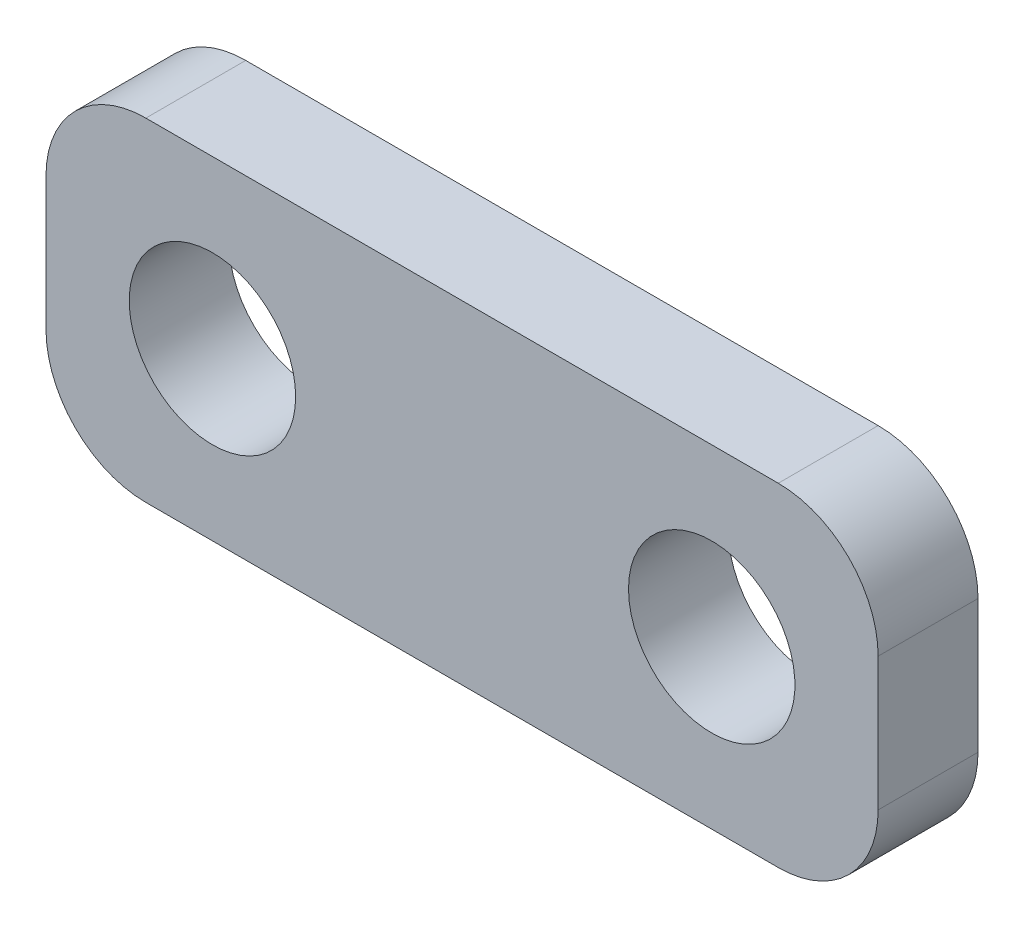
from build123d import *

# Parameters (mm, degrees)
SKETCH_1_W      = 25
SKETCH_1_H      = 10
SKETCH_1_R      = 2.5
EXTRUDE_1_DEPTH = 3
FILLET_1_R      = 3


with BuildPart() as part:
    # 草图1 → 凸台-拉伸1 (new body)
    with BuildSketch(Plane.XY):
        Rectangle(SKETCH_1_W, SKETCH_1_H)
        with Locations((-7.5, 0)):
            Circle(SKETCH_1_R, mode=Mode.SUBTRACT)
        with Locations(Location((7.5, 0, 0), (0, 0, 180))):
            Circle(SKETCH_1_R, mode=Mode.SUBTRACT)
    extrude(amount=EXTRUDE_1_DEPTH)

    # 圆角1
    fillet_1_edges = [part.edges().sort_by_distance(p)[0] for p in [
        (12.5, -5, 1.5),
        (-12.5, -5, 1.5),
        (-12.5, 5, 1.5),
        (12.5, 5, 1.5),
    ]]
    fillet(fillet_1_edges, radius=FILLET_1_R)


solid = part.part
